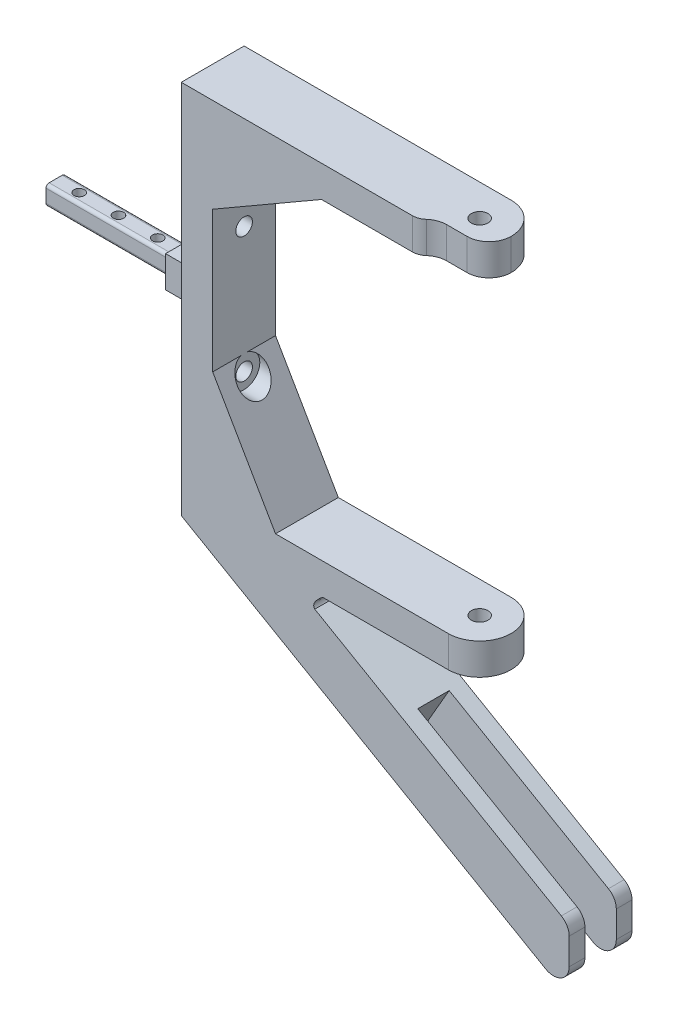
from build123d import *
from OCP.BRepFilletAPI import BRepFilletAPI_MakeChamfer, BRepFilletAPI_MakeFillet

# Parameters (mm, degrees)
EXTRUDE_1_DEPTH     = 20
EXTRUDE_2_DEPTH     = 10
EXTRUDE_START       = 10
EXTRUDE_3_DEPTH     = 40
CUT_EXTRUDE_1_DEPTH = 149.00422291272636
FILLET_1_R          = 1
SKETCH_7_R          = 1.6500000000000021
SKETCH_7_R_2        = 1.6499999999999988
CUT_EXTRUDE_2_DEPTH = 108.57314081591156
CHAMFER_1_SIZE      = 20.000000000000007
CHAMFER_1_SIZE2     = 34.64101615137772
CUT_EXTRUDE_3_REACH = 150.004
FILLET_2_R1         = 5
FILLET_2_R2         = 7
CUT_EXTRUDE_4_REACH = 115.996
CUT_EXTRUDE_START   = -15.710581
CUT_EXTRUDE_5_DEPTH = 5.7105809999999995
BOSS_EXTRUDE1_DEPTH = 20.000000000000004
SKETCH4_W           = 72.89110280441945
SKETCH4_H           = 10.000000000000005
CUT_EXTRUDE1_DEPTH  = 29.000000000000004


with BuildPart() as part:
    # 草图1 → 凸台-拉伸1 (new body)
    with BuildSketch(Plane.XY):
        Polygon((-1.953e-14, 49.75), (1.093e-14, -49.75), (85.00000000000001, -49.74999999999995), (85.00000000000001, -59.74999999999995), (-9.999999999999986, -59.74999999999995), (-9.999999999999995, 59.749999999999986), (85, 59.75000000000001), (84.99999999999999, 49.75), align=None)
    extrude(amount=EXTRUDE_1_DEPTH)

    # 草图3 → 凸台-拉伸2 (add)
    # profile 1 of 2: a face of its own
    with BuildSketch(Plane.ZY.offset(9.99999999999999)):
        Polygon((15, 5.000000000000008), (15, -4.999999999999993), (5.000000000000002, -4.999999999999993), (5, 5.000000000000007), align=None)
        Polygon((6.925000000000001, 3.075000000000007), (6.925000000000002, -3.074999999999993), (13.075, -3.074999999999993), (13.075, 3.075000000000007), align=None, mode=Mode.SUBTRACT)
    # profile 2 of 2: a face of its own
    with BuildSketch(Plane.ZY.offset(9.99999999999999)):
        Polygon((6.925000000000001, 3.075000000000007), (13.075, 3.075000000000007), (13.075, -3.074999999999993), (6.925000000000002, -3.074999999999993), align=None)
    extrude(amount=EXTRUDE_2_DEPTH)

    # 草图3<3> → 凸台-拉伸3 (add)
    with BuildSketch(Plane.ZY.offset(9.99999999999999).offset(EXTRUDE_START)):
        Polygon((6.925000000000001, 3.075000000000007), (13.075, 3.075000000000007), (13.075, -3.074999999999993), (6.925000000000002, -3.074999999999993), align=None)
    extrude(amount=EXTRUDE_3_DEPTH)

    # 草图5 → 切除-拉伸1 (cut, through all)
    with BuildSketch(Plane(origin=(-1.309e-14, 59.749999999999986, 0), x_dir=(1, 2.3e-16, 0), z_dir=(-2.3e-16, 1, 0))):
        with BuildLine():
            ThreePointArc((72.34999999999964, -10), (74.99999999999964, -12.65), (77.64999999999965, -10))
            Line((77.64999999999965, -9.99999999999999), (72.34999999999964, -9.999999999999991))
        make_face()
        with BuildLine():
            Line((72.34999999999964, -9.999999999999991), (77.64999999999965, -9.99999999999999))
            ThreePointArc((77.64999999999965, -10), (74.99999999999964, -7.35), (72.34999999999964, -9.999999999999998))
        make_face()
        with BuildLine():
            Line((85.00000000000001, -20), (85.00000000000001, -9.999999999999995))
            ThreePointArc((84.99999999999964, -10.000000000000002), (82.07106781186489, -17.071067811865692), (74.99999999999903, -19.999999999999993))
            Line((74.99999999999903, -20), (85.00000000000001, -20))
        make_face()
        with BuildLine():
            ThreePointArc((74.99999999999908, -5.33e-15), (82.07106781186492, -2.928932188134328), (84.99999999999964, -10))
            Line((85.00000000000001, -9.999999999999995), (85.00000000000001, 0))
            Line((85.00000000000001, 0), (74.99999999999908, 0))
        make_face()
    extrude(amount=-CUT_EXTRUDE_1_DEPTH, mode=Mode.SUBTRACT)

    # 圆角1
    fillet_1_edges = [part.edges().sort_by_distance(p)[0] for p in [
        (-39.999999999999986, -3.0749999999999953, 6.925000000000002),
        (-39.999999999999986, -3.0749999999999953, 13.075),
        (-39.999999999999986, 3.0750000000000046, 13.075),
        (-39.999999999999986, 3.0750000000000046, 6.925000000000001),
    ]]
    fillet(fillet_1_edges, radius=FILLET_1_R)

    # 草图7 → 切除-拉伸2 (cut, through all)
    with BuildSketch(Plane(origin=(-1.6e-16, 3.0750000000000064, 0), x_dir=(1, 5e-17, 0), z_dir=(-5e-17, 1, 0))):
        with Locations(Location((-39.99999999999999, -10, 0), (0, 0, 180))):
            Circle(SKETCH_7_R)
        with Locations(Location((-52.49999999999999, -10.000000000000002, 0), (0, 0, 180))):
            Circle(SKETCH_7_R)
        with Locations(Location((-27.499999999999993, -9.999999999999998, 0), (0, 0, 180))):
            Circle(SKETCH_7_R_2)
    extrude(amount=-CUT_EXTRUDE_2_DEPTH, mode=Mode.SUBTRACT)

    # 倒角1: one chamfer whose edges measure the first distance from different faces: ONE call of the kernel's chamfer builder (chamfer() names one face for all edges)
    chamfer_1_edges_1 = [part.edges().sort_by_distance(p)[0] for p in [
        (-1.953e-14, 49.75, 10),
    ]]
    chamfer_1_side_1 = [part.faces().sort_by_distance(p)[0] for p in [
        (-4.3e-15, -1.94e-15, 10),
    ]]
    chamfer_1_edges_2 = [part.edges().sort_by_distance(p)[0] for p in [
        (1.093e-14, -49.75, 10),
    ]]
    chamfer_1_side_2 = [part.faces().sort_by_distance(p)[0] for p in [
        (41.004447540474715, -49.74999999999998, 9.99999999999999),
    ]]
    chamfer_1 = BRepFilletAPI_MakeChamfer(part.part.solid().wrapped)
    for e in chamfer_1_edges_1:
        chamfer_1.Add(CHAMFER_1_SIZE, CHAMFER_1_SIZE2, e.wrapped, chamfer_1_side_1[0].wrapped)  # the first distance lies on this face
    for e in chamfer_1_edges_2:
        chamfer_1.Add(CHAMFER_1_SIZE, CHAMFER_1_SIZE2, e.wrapped, chamfer_1_side_2[0].wrapped)  # the first distance lies on this face
    add(Compound.cast(chamfer_1.Shape()), mode=Mode.REPLACE)

    # 草图8 → 切除-拉伸3 (cut, up to next)
    with BuildSketch(Plane(origin=(-1.309e-14, 59.749999999999986, 0), x_dir=(1, 2.2e-16, 0), z_dir=(-2.2e-16, 1, 0)), mode=Mode.PRIVATE) as cut_extrude_3_sk1:
        with BuildLine():
            ThreePointArc((74.99999999999964, -20), (78.87298334620706, -19.219544457292884), (82.14142842854251, -16.99999999999999))
            Line((82.14142842854251, -16.999999999999993), (71.47264625833486, -16.999999999999993))
            ThreePointArc((71.47264625833486, -16.999999999999993), (68.23227590913093, -17.795163177004564), (65.72808361179683, -20.000000000000007))
            Line((65.72808361179683, -20), (74.99999999999964, -20))
        make_face()
    cut_extrude_3_tool1 = extrude(cut_extrude_3_sk1.sketch, amount=-CUT_EXTRUDE_3_REACH, mode=Mode.PRIVATE) & part.part
    add(cut_extrude_3_tool1.solids().sort_by_distance((73.723085, 59.75, 18.477053))[0], mode=Mode.SUBTRACT)

    # 圆角2: one fillet with a radius per group of edges: ONE call of the kernel's fillet builder (fillet() takes one radius for all edges)
    fillet_2_edges_1 = [part.edges().sort_by_distance(p)[0] for p in [
        (65.72808361179682, 54.75, 20.000000000000004),
    ]]
    fillet_2_edges_2 = [part.edges().sort_by_distance(p)[0] for p in [
        (82.1414284285425, 54.75, 16.999999999999993),
    ]]
    fillet_2 = BRepFilletAPI_MakeFillet(part.part.solid().wrapped)
    for e in fillet_2_edges_1:
        fillet_2.Add(FILLET_2_R1, e.wrapped)
    for e in fillet_2_edges_2:
        fillet_2.Add(FILLET_2_R2, e.wrapped)
    add(Compound.cast(fillet_2.Shape()), mode=Mode.REPLACE)

    # 草图10 → 切除-拉伸4 (cut, up to next)
    with BuildSketch(Plane.ZY.offset(9.99999999999999), mode=Mode.PRIVATE) as cut_extrude_4_sk1:
        with BuildLine():
            ThreePointArc((12.649999999999984, 20.00000000000003), (11.873832970144308, 21.873832970144406), (9.999999999999908, 22.650000000000027))
            Line((9.999999999999988, 22.650000000000027), (9.999999999999988, 20.00000000000003))
            Line((9.999999999999988, 20.00000000000003), (9.99999999999999, 17.35000000000003))
            ThreePointArc((9.999999999999908, 17.35000000000003), (11.873832970144308, 18.12616702985565), (12.649999999999984, 20.00000000000003))
        make_face()
    cut_extrude_4_tool1 = extrude(cut_extrude_4_sk1.sketch, amount=-CUT_EXTRUDE_4_REACH, mode=Mode.PRIVATE) & part.part
    # 草图10 → 切除-拉伸4 (cut, up to next)
    with BuildSketch(Plane.ZY.offset(9.99999999999999), mode=Mode.PRIVATE) as cut_extrude_4_sk2:
        with BuildLine():
            Line((9.999999999999988, 20.00000000000003), (9.999999999999988, 22.650000000000027))
            ThreePointArc((9.999999999999908, 22.650000000000027), (7.349999999999984, 20.00000000000003), (9.999999999999908, 17.35000000000003))
            Line((9.99999999999999, 17.35000000000003), (9.999999999999988, 20.00000000000003))
        make_face()
    cut_extrude_4_tool2 = extrude(cut_extrude_4_sk2.sketch, amount=-CUT_EXTRUDE_4_REACH, mode=Mode.PRIVATE) & part.part
    # 草图10 → 切除-拉伸4 (cut, up to next)
    with BuildSketch(Plane.ZY.offset(9.99999999999999), mode=Mode.PRIVATE) as cut_extrude_4_sk3:
        with BuildLine():
            ThreePointArc((12.649999999999984, 20.00000000000003), (11.873832970144308, 21.873832970144406), (9.999999999999908, 22.650000000000027))
            Line((9.999999999999988, 22.650000000000027), (9.999999999999988, 20.00000000000003))
            Line((9.999999999999988, 20.00000000000003), (9.99999999999999, 17.35000000000003))
            ThreePointArc((9.999999999999908, 17.35000000000003), (11.873832970144308, 18.12616702985565), (12.649999999999984, 20.00000000000003))
        make_face()
    cut_extrude_4_tool3 = extrude(cut_extrude_4_sk3.sketch, amount=-CUT_EXTRUDE_4_REACH, mode=Mode.PRIVATE) & part.part
    # 草图10 → 切除-拉伸4 (cut, up to next)
    with BuildSketch(Plane.ZY.offset(9.99999999999999), mode=Mode.PRIVATE) as cut_extrude_4_sk4:
        with BuildLine():
            Line((9.999999999999988, 20.00000000000003), (9.999999999999988, 22.650000000000027))
            ThreePointArc((9.999999999999908, 22.650000000000027), (7.349999999999984, 20.00000000000003), (9.999999999999908, 17.35000000000003))
            Line((9.99999999999999, 17.35000000000003), (9.999999999999988, 20.00000000000003))
        make_face()
    cut_extrude_4_tool4 = extrude(cut_extrude_4_sk4.sketch, amount=-CUT_EXTRUDE_4_REACH, mode=Mode.PRIVATE) & part.part
    # 草图10 → 切除-拉伸4 (cut, up to next)
    with BuildSketch(Plane.ZY.offset(9.99999999999999), mode=Mode.PRIVATE) as cut_extrude_4_sk5:
        with BuildLine():
            ThreePointArc((12.649999999999997, -19.99999999999997), (11.873832970144319, -18.12616702985559), (9.999999999999915, -17.349999999999973))
            Line((9.999999999999993, -17.349999999999966), (9.999999999999995, -19.99999999999997))
            Line((9.999999999999995, -19.99999999999997), (9.999999999999995, -22.649999999999977))
            ThreePointArc((9.999999999999917, -22.64999999999997), (11.873832970144319, -21.873832970144353), (12.649999999999997, -19.99999999999997))
        make_face()
    cut_extrude_4_tool5 = extrude(cut_extrude_4_sk5.sketch, amount=-CUT_EXTRUDE_4_REACH, mode=Mode.PRIVATE) & part.part
    # 草图10 → 切除-拉伸4 (cut, up to next)
    with BuildSketch(Plane.ZY.offset(9.99999999999999), mode=Mode.PRIVATE) as cut_extrude_4_sk6:
        with BuildLine():
            Line((9.999999999999995, -19.99999999999997), (9.999999999999993, -17.349999999999966))
            ThreePointArc((9.999999999999915, -17.349999999999973), (7.349999999999996, -19.99999999999997), (9.999999999999917, -22.64999999999997))
            Line((9.999999999999995, -22.649999999999977), (9.999999999999995, -19.99999999999997))
        make_face()
    cut_extrude_4_tool6 = extrude(cut_extrude_4_sk6.sketch, amount=-CUT_EXTRUDE_4_REACH, mode=Mode.PRIVATE) & part.part
    # 草图10 → 切除-拉伸4 (cut, up to next)
    with BuildSketch(Plane.ZY.offset(9.99999999999999), mode=Mode.PRIVATE) as cut_extrude_4_sk7:
        with BuildLine():
            ThreePointArc((12.649999999999997, -19.99999999999997), (11.873832970144319, -18.12616702985559), (9.999999999999915, -17.349999999999973))
            Line((9.999999999999993, -17.349999999999966), (9.999999999999995, -19.99999999999997))
            Line((9.999999999999995, -19.99999999999997), (9.999999999999995, -22.649999999999977))
            ThreePointArc((9.999999999999917, -22.64999999999997), (11.873832970144319, -21.873832970144353), (12.649999999999997, -19.99999999999997))
        make_face()
    cut_extrude_4_tool7 = extrude(cut_extrude_4_sk7.sketch, amount=-CUT_EXTRUDE_4_REACH, mode=Mode.PRIVATE) & part.part
    # 草图10 → 切除-拉伸4 (cut, up to next)
    with BuildSketch(Plane.ZY.offset(9.99999999999999), mode=Mode.PRIVATE) as cut_extrude_4_sk8:
        with BuildLine():
            Line((9.999999999999995, -19.99999999999997), (9.999999999999993, -17.349999999999966))
            ThreePointArc((9.999999999999915, -17.349999999999973), (7.349999999999996, -19.99999999999997), (9.999999999999917, -22.64999999999997))
            Line((9.999999999999995, -22.649999999999977), (9.999999999999995, -19.99999999999997))
        make_face()
    cut_extrude_4_tool8 = extrude(cut_extrude_4_sk8.sketch, amount=-CUT_EXTRUDE_4_REACH, mode=Mode.PRIVATE) & part.part
    add(cut_extrude_4_tool1.solids().sort_by_distance((-10, 20, 11.124695))[0], mode=Mode.SUBTRACT)
    add(cut_extrude_4_tool2.solids().sort_by_distance((-10, 20, 8.875305))[0], mode=Mode.SUBTRACT)
    add(cut_extrude_4_tool3.solids().sort_by_distance((-10, 20, 11.124695))[0], mode=Mode.SUBTRACT)
    add(cut_extrude_4_tool4.solids().sort_by_distance((-10, 20, 8.875305))[0], mode=Mode.SUBTRACT)
    add(cut_extrude_4_tool5.solids().sort_by_distance((-10, -20, 11.124695))[0], mode=Mode.SUBTRACT)
    add(cut_extrude_4_tool6.solids().sort_by_distance((-10, -20, 8.875305))[0], mode=Mode.SUBTRACT)
    add(cut_extrude_4_tool7.solids().sort_by_distance((-10, -20, 11.124695))[0], mode=Mode.SUBTRACT)
    add(cut_extrude_4_tool8.solids().sort_by_distance((-10, -20, 8.875305))[0], mode=Mode.SUBTRACT)

    # 草图10<3> → 切除-拉伸5 (cut)
    with BuildSketch(Plane.ZY.offset(9.99999999999999).offset(CUT_EXTRUDE_START)):
        with BuildLine():
            ThreePointArc((14.999999999999996, -19.99999999999997), (13.535533905932759, -16.46446609406726), (10.000000000000064, -14.999999999999972))
            Line((9.999999999999993, -14.999999999999972), (9.999999999999993, -17.349999999999966))
            ThreePointArc((9.999999999999915, -17.349999999999973), (11.873832970144319, -18.12616702985559), (12.649999999999997, -19.99999999999997))
            ThreePointArc((12.649999999999997, -19.99999999999997), (11.873832970144319, -21.873832970144353), (9.999999999999917, -22.64999999999997))
            Line((9.999999999999995, -22.649999999999977), (9.999999999999995, -24.99999999999997))
            ThreePointArc((10.000000000000057, -24.99999999999997), (13.535533905932756, -23.535533905932688), (14.999999999999996, -19.99999999999997))
        make_face()
        with BuildLine():
            Line((9.999999999999993, -17.349999999999966), (9.999999999999993, -14.999999999999972))
            ThreePointArc((10.000000000000064, -14.999999999999972), (4.999999999999996, -19.999999999999968), (10.000000000000057, -24.99999999999997))
            Line((9.999999999999995, -24.99999999999997), (9.999999999999995, -22.649999999999977))
            ThreePointArc((9.999999999999917, -22.64999999999997), (7.349999999999996, -19.99999999999997), (9.999999999999915, -17.349999999999973))
        make_face()
    extrude(amount=CUT_EXTRUDE_5_DEPTH, mode=Mode.SUBTRACT)

    # Sketch1 → Boss-Extrude1 (add)
    with BuildSketch(Plane.XY.offset(20)):
        with BuildLine():
            Line((-9.999999999999986, -59.74999999999996), (106.00000000000001, -126.7226312259967))
            ThreePointArc((106.00000000000001, -126.7226312259967), (111.00000000000001, -126.72263122599672), (113.50000000000001, -122.39250420707452))
            Line((113.50000000000001, -122.39250420707452), (113.5, -113.939509590867))
            ThreePointArc((113.5, -113.939509590867), (112.8301270189222, -111.439509590867), (111, -109.60938257194482))
            Line((111, -109.60938257194482), (32.49747535530764, -64.28592883626634))
            add(Edge.make_bspline(
                [(35.00000000000001, -59.74999999999995), (31.175910828961968, -62.87321170356669), (32.49747535530764, -64.28592883626634)],
                knots=[0, 0, 0, 1, 1, 1], degree=2))
            Line((35.00000000000001, -59.74999999999995), (-9.999999999999986, -59.74999999999996))
        make_face()
    extrude(amount=-BOSS_EXTRUDE1_DEPTH)

    # Sketch4 → Cut-Extrude1 (cut)
    with BuildSketch(Plane(origin=(-19.71225490021572, -34.14262701892212, 0), x_dir=(0.8660254037844382, -0.500000000000001, 0), z_dir=(0.5000000000000009, 0.866025403784438, 0))):
        with Locations((128.82497002974355, -10)):
            Rectangle(SKETCH4_W, SKETCH4_H)
    extrude(amount=-CUT_EXTRUDE1_DEPTH, mode=Mode.SUBTRACT)


solid = part.part
